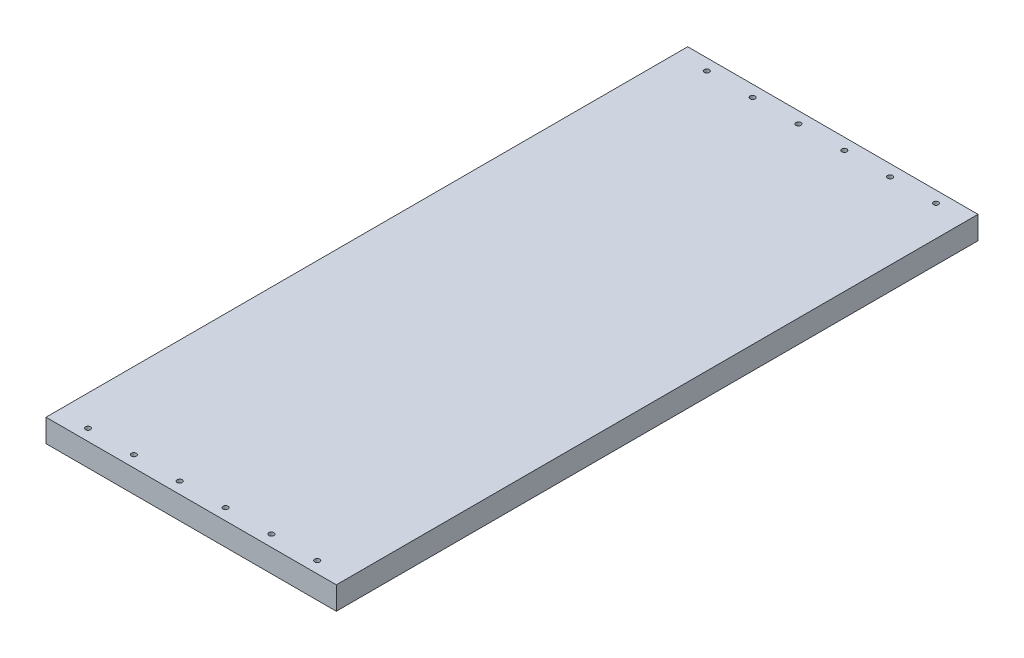
from build123d import *

# Parameters (mm, degrees)
SKETCH2_W                                         = 482.6
SKETCH2_H                                         = 38.1
BOSS_EXTRUDE1_DEPTH                               = 1066.8
CSK_FOR_5_16_FLAT_HEAD_MACHINE_SCREW1_D           = 8.4328
CSK_FOR_5_16_FLAT_HEAD_MACHINE_SCREW1_CSINK_D     = 16.129
CSK_FOR_5_16_FLAT_HEAD_MACHINE_SCREW1_CSINK_ANGLE = 82


with BuildPart() as part:
    # Sketch2 → Boss-Extrude1 (new body)
    with BuildSketch(Plane.XY):
        Rectangle(SKETCH2_W, SKETCH2_H)
    extrude(amount=BOSS_EXTRUDE1_DEPTH)

    # CSK for 5/16 Flat Head Machine Screw1 (through all)
    with Locations(Plane(origin=(0, -19.05, 0), x_dir=(-1, 0, 0), z_dir=(0, -1, 0))):
        with Locations((190.5, -1047.75), (114.3, -1047.75), (38.1, -1047.75), (-38.1, -1047.75), (-114.3, -1047.75), (-190.5, -1047.75), (114.3, -19.05), (38.1, -19.05), (-38.1, -19.05), (-114.3, -19.05), (-190.5, -19.05), (190.5, -19.05)):
            CounterSinkHole(CSK_FOR_5_16_FLAT_HEAD_MACHINE_SCREW1_D / 2, CSK_FOR_5_16_FLAT_HEAD_MACHINE_SCREW1_CSINK_D / 2, counter_sink_angle=CSK_FOR_5_16_FLAT_HEAD_MACHINE_SCREW1_CSINK_ANGLE)


solid = part.part
